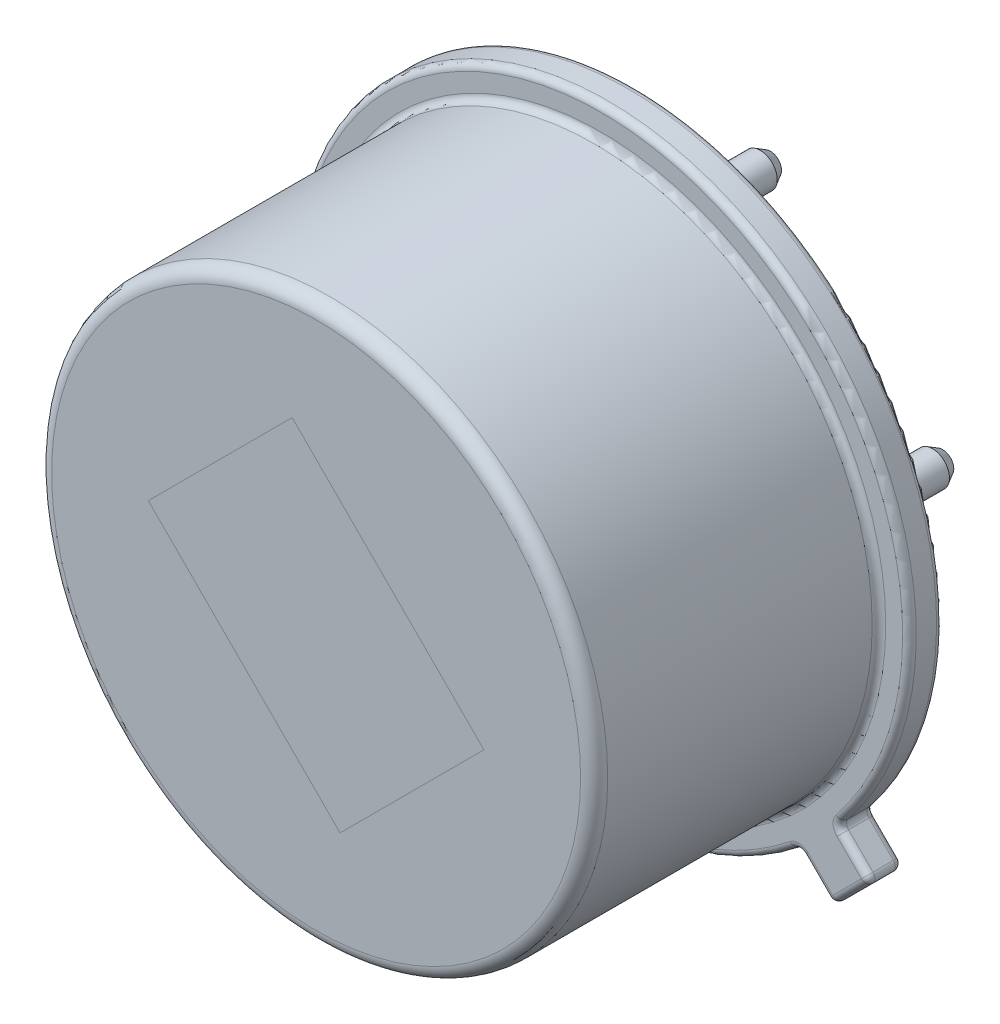
from build123d import *
from OCP.BRepFilletAPI import BRepFilletAPI_MakeChamfer

# Parameters (mm, degrees)
EXTRUDE1_DEPTH      = 0.5
SKETCH2_R           = 4.1
EXTRUDE2_DEPTH      = 4.2
EXTRUDE3_DEPTH      = 0.9
SKETCH4_R           = 0.25
EXTRUDE4_DEPTH      = 2
EXTRUDE5_DEPTH      = 0.9
FILLET1_R           = 0.2
FILLET2_R           = 0.1
CHAMFER1_SIZE       = 0.15
CHAMFER1_SIZE2      = 0.08660254
CUT_EXTRUDE_START   = -0.01
SKETCH_1_R          = 0.8
SKETCH_1_R_2        = 0.25
CUT_EXTRUDE_1_DEPTH = 0.01


with BuildPart() as part:
    # Sketch1 → Extrude1 (new body)
    with BuildSketch(Plane.XY):
        with BuildLine():
            Line((3.982696552, -3.417011127), (3.417011127, -3.982696552))
            Line((3.417011127, -3.982696552), (2.92203638, -3.487721805))
            ThreePointArc((2.92203638, -3.487721805), (-3.217335854, 3.217335854), (3.487721805, -2.92203638))
            Line((3.487721805, -2.92203638), (3.982696552, -3.417011127))
        make_face()
    extrude(amount=EXTRUDE1_DEPTH)

    # Sketch2 → Extrude2 (add)
    with BuildSketch(Plane.XY.offset(0.5)):
        Circle(SKETCH2_R)
    extrude(amount=EXTRUDE2_DEPTH)

    # Sketch3 → Extrude3 (cut)
    with BuildSketch(Plane.XY.offset(4.7)):
        Polygon((-2.474873734, 0.353553391), (0.353553391, -2.474873734), (2.474873734, -0.353553391), (-0.353553391, 2.474873734), align=None)
    extrude(amount=-EXTRUDE3_DEPTH, mode=Mode.SUBTRACT)

    # Sketch4 → Extrude4 (add)
    with BuildSketch(Plane(origin=(0, 0, 0), x_dir=(-1, 0, 0), z_dir=(0, 0, -1))):
        with Locations(Location((-2.54, 0, 0), (0, 0, 180))):
            Circle(SKETCH4_R)
        with Locations(Location((0, 2.54, 0), (0, 0, 180))):
            Circle(SKETCH4_R)
        with Locations(Location((2.54, 0, 0), (0, 0, 180))):
            Circle(SKETCH4_R)
    extrude(amount=EXTRUDE4_DEPTH)

    # Fillet1
    fillet1_edges = [part.edges().sort_by_distance(p)[0] for p in [
        (-4.1, 0, 4.7),
    ]]
    fillet(fillet1_edges, radius=FILLET1_R)

    # Fillet2
    fillet2_edges = [part.edges().sort_by_distance(p)[0] for p in [
        (3.169523754, -3.735209179, 0.5),
        (3.69985384, -3.69985384, 0.5),
        (-4.1, 0, 0.5),
        (-2.79, 0, 0),
        (3.735209179, -3.169523754, 0.5),
        (3.69985384, -3.69985384, 0),
        (3.169523754, -3.735209179, 0),
        (-3.217335854, 3.217335854, 0),
        (3.735209179, -3.169523754, 0),
        (-3.217335854, 3.217335854, 0.5),
        (3.982696552, -3.417011127, 0.25),
        (3.417011127, -3.982696552, 0.25),
        (2.92203638, -3.487721805, 0.25),
        (3.487721805, -2.92203638, 0.25),
    ]]
    fillet(fillet2_edges, radius=FILLET2_R)

    # Chamfer1: one chamfer whose edges measure the first distance from different faces: ONE call of the kernel's chamfer builder (chamfer() names one face for all edges)
    chamfer1_edges_1 = [part.edges().sort_by_distance(p)[0] for p in [
        (2.29, 0, -2),
    ]]
    chamfer1_side_1 = [part.faces().sort_by_distance(p)[0] for p in [
        (2.29, 0, -1),
    ]]
    chamfer1_edges_2 = [part.edges().sort_by_distance(p)[0] for p in [
        (-0.25, 2.54, -2),
    ]]
    chamfer1_side_2 = [part.faces().sort_by_distance(p)[0] for p in [
        (-0.25, 2.54, -1),
    ]]
    chamfer1_edges_3 = [part.edges().sort_by_distance(p)[0] for p in [
        (-2.79, 0, -2),
    ]]
    chamfer1_side_3 = [part.faces().sort_by_distance(p)[0] for p in [
        (-2.79, 0, -1.05),
    ]]
    chamfer1 = BRepFilletAPI_MakeChamfer(part.part.solid().wrapped)
    for e in chamfer1_edges_1:
        chamfer1.Add(CHAMFER1_SIZE, CHAMFER1_SIZE2, e.wrapped, chamfer1_side_1[0].wrapped)  # the first distance lies on this face
    for e in chamfer1_edges_2:
        chamfer1.Add(CHAMFER1_SIZE, CHAMFER1_SIZE2, e.wrapped, chamfer1_side_2[0].wrapped)  # the first distance lies on this face
    for e in chamfer1_edges_3:
        chamfer1.Add(CHAMFER1_SIZE, CHAMFER1_SIZE2, e.wrapped, chamfer1_side_3[0].wrapped)  # the first distance lies on this face
    add(Compound.cast(chamfer1.Shape()), mode=Mode.REPLACE)

    # Эскиз1 → Вырез-Вытянуть1 (cut)
    # profile 1 of 2: a face of its own
    with BuildSketch(Plane(origin=(0, 0, 0), x_dir=(-1, 0, 0), z_dir=(0, 0, -1)).offset(CUT_EXTRUDE_START)):
        with Locations((0, 2.54)):
            Circle(SKETCH_1_R)
        with Locations((0, 2.54)):
            Circle(SKETCH_1_R_2, mode=Mode.SUBTRACT)
    # profile 2 of 2: a face of its own
    with BuildSketch(Plane(origin=(0, 0, 0), x_dir=(-1, 0, 0), z_dir=(0, 0, -1)).offset(CUT_EXTRUDE_START)):
        with Locations((-2.54, 0)):
            Circle(SKETCH_1_R)
        with Locations((-2.54, 0)):
            Circle(SKETCH_1_R_2, mode=Mode.SUBTRACT)
    extrude(amount=CUT_EXTRUDE_1_DEPTH, mode=Mode.SUBTRACT)


with BuildPart() as body_2:
    # Sketch5 → Extrude5 (new body)
    with BuildSketch(Plane.XY.offset(3.8)):
        Polygon((-0.353553391, 2.474873734), (2.474873734, -0.353553391), (0.353553391, -2.474873734), (-2.474873734, 0.353553391), align=None)
    extrude(amount=EXTRUDE5_DEPTH)


solid = Compound([part.part, body_2.part])
